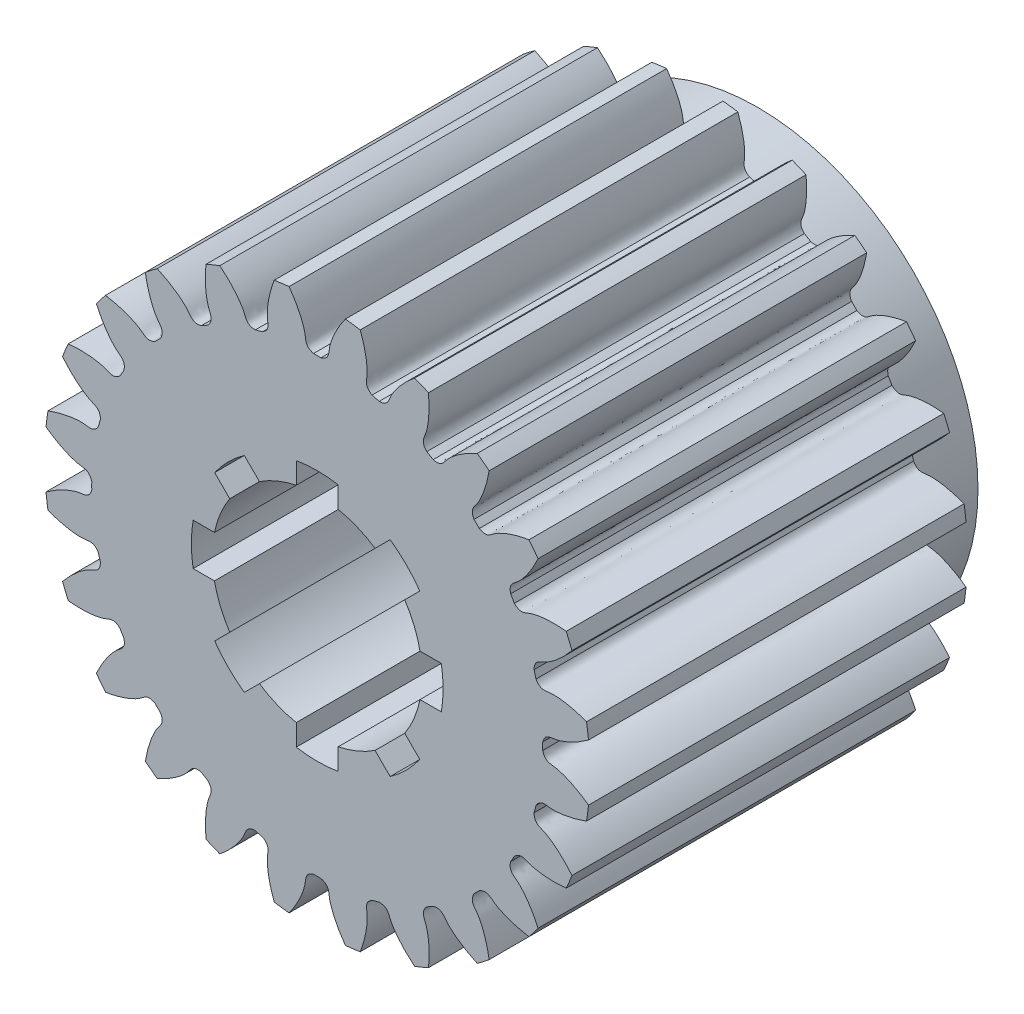
from build123d import *

# Parameters (mm, degrees)
SKETCH_1_R               = 13
EXTRUDE_1_DEPTH          = 18
CUT_EXTRUDE_1_DEPTH      = 26.729360661
PATTERN_CIRCULAR_1_COUNT = 24
SKETCH_4_R               = 10.5
EXTRUDE_2_DEPTH          = 3
CUT_EXTRUDE_3_DEPTH      = 28.845957889
CUT_EXTRUDE_3_DEPTH_BACK = 28.845957889


with BuildPart() as part:
    # 草图1 → 凸台-拉伸1 (new body)
    with BuildSketch(Plane.XY):
        Circle(SKETCH_1_R)
    extrude(amount=EXTRUDE_1_DEPTH)

    # 草图2 → 切除-拉伸1 (cut, through all)
    with BuildSketch(Plane.XY):
        with BuildLine():
            ThreePointArc((0.176831912, 10.748545505), (0, 10.75), (-0.176831912, 10.748545505))
            add(Edge.make_bspline(
                [(-0.176831912, 10.748545505), (-0.567912216, 10.856860072), (-0.539047766, 11.115723597), (-0.586277177, 11.372684453), (-0.593035917, 11.405833043), (-0.601448484, 11.443240145), (-0.611680608, 11.484852715), (-0.623905634, 11.530610673), (-0.638292299, 11.580449371), (-0.655008422, 11.634298869), (-0.674219578, 11.692084221), (-0.696089327, 11.753725457), (-0.720778968, 11.819137654), (-0.748447442, 11.88823099), (-0.779251189, 11.96091081), (-0.813344022, 12.037077686), (-0.850876998, 12.116627487), (-0.891998291, 12.199451452), (-0.93685307, 12.285436259), (-0.985583373, 12.374464108), (-1.038327991, 12.466412797), (-1.095222341, 12.561155811), (-1.156398359, 12.658562402), (-1.221984378, 12.758497683), (-1.292105019, 12.860822717), (-1.366881079, 12.965394618), (-1.446429425, 13.072066641), (-1.530862887, 13.180688288), (-1.620290156, 13.291105411), (-1.714815684, 13.403160315), (-1.814539583, 13.516691871), (-1.919557535, 13.63153562), (-2.029960694, 13.747523897), (-2.145835601, 13.864485934), (-2.267264093, 13.982247989), (-2.394323221, 14.10063346), (-2.527085177, 14.21946301), (-2.665617174, 14.338554691), (-2.860422093, 14.499361556), (-3.011923806, 14.616878318), (-3.11561952, 14.694117929)],
                knots=[0, 0, 0, 0, 0.143961355, 0.149818462, 0.156576662, 0.164235955, 0.172796342, 0.182257821, 0.192620395, 0.203884061, 0.216048821, 0.229114674, 0.24308162, 0.25794966, 0.273718793, 0.290389019, 0.307960339, 0.326432751, 0.345806258, 0.366080857, 0.38725655, 0.409333336, 0.432311215, 0.456190188, 0.480970254, 0.506651413, 0.533233666, 0.560717012, 0.589101451, 0.618386984, 0.64857361, 0.679661329, 0.711650141, 0.744540047, 0.778331046, 0.813023138, 0.848616324, 0.885110603, 0.922505975, 1, 1, 1, 1], degree=3))
            ThreePointArc((-3.11561952, 14.694117929), (0, 15.020791814), (3.11561952, 14.694117929))
            add(Edge.make_bspline(
                [(0.176831912, 10.748545505), (0.567912216, 10.856860072), (0.539047766, 11.115723597), (0.586277177, 11.372684453), (0.593035917, 11.405833043), (0.601448484, 11.443240145), (0.611680608, 11.484852715), (0.623905634, 11.530610673), (0.638292299, 11.580449371), (0.655008422, 11.634298869), (0.674219578, 11.692084221), (0.696089327, 11.753725457), (0.720778968, 11.819137654), (0.748447442, 11.88823099), (0.779251189, 11.96091081), (0.813344022, 12.037077686), (0.850876998, 12.116627487), (0.891998291, 12.199451452), (0.93685307, 12.285436259), (0.985583373, 12.374464108), (1.038327991, 12.466412797), (1.095222341, 12.561155811), (1.156398359, 12.658562402), (1.221984378, 12.758497683), (1.292105019, 12.860822717), (1.366881079, 12.965394618), (1.446429425, 13.072066641), (1.530862887, 13.180688288), (1.620290156, 13.291105411), (1.714815684, 13.403160315), (1.814539583, 13.516691871), (1.919557535, 13.63153562), (2.029960694, 13.747523897), (2.145835601, 13.864485934), (2.267264093, 13.982247989), (2.394323221, 14.10063346), (2.527085177, 14.21946301), (2.665617174, 14.338554691), (2.860422093, 14.499361556), (3.011923806, 14.616878318), (3.11561952, 14.694117929)],
                knots=[0, 0, 0, 0, 0.143961355, 0.149818462, 0.156576662, 0.164235955, 0.172796342, 0.182257821, 0.192620395, 0.203884061, 0.216048821, 0.229114674, 0.24308162, 0.25794966, 0.273718793, 0.290389019, 0.307960339, 0.326432751, 0.345806258, 0.366080857, 0.38725655, 0.409333336, 0.432311215, 0.456190188, 0.480970254, 0.506651413, 0.533233666, 0.560717012, 0.589101451, 0.618386984, 0.64857361, 0.679661329, 0.711650141, 0.744540047, 0.778331046, 0.813023138, 0.848616324, 0.885110603, 0.922505975, 1, 1, 1, 1], degree=3))
        make_face()
    cut_extrude_1 = extrude(amount=CUT_EXTRUDE_1_DEPTH, mode=Mode.SUBTRACT)

    # 阵列(圆周)1: 切除-拉伸1 ×24 about axis
    pattern_circular_1_axis = Axis((0, 0, 18), (0, 0, -1))
    for i in range(1, PATTERN_CIRCULAR_1_COUNT):
        add(cut_extrude_1.rotate(pattern_circular_1_axis, i * 360 / PATTERN_CIRCULAR_1_COUNT), mode=Mode.SUBTRACT)

    # 草图4 → 凸台-拉伸2 (add)
    with BuildSketch(Plane(origin=(0, 0, 0), x_dir=(-1, 0, 0), z_dir=(0, 0, -1))):
        Circle(SKETCH_4_R)
    extrude(amount=EXTRUDE_2_DEPTH)

    # 草图5 → 切除-拉伸3 (cut, two sides: drawn at the far end of the back side and taken through both)
    with BuildSketch(Plane(origin=(0, 0, -3), x_dir=(-1, 0, 0), z_dir=(0, 0, -1)).offset(-CUT_EXTRUDE_3_DEPTH_BACK)):
        with BuildLine():
            ThreePointArc((1, 5.916079783), (0, 6), (-1, 5.916079783))
            Line((-1, 5.916079783), (-1, 4.898979486))
            ThreePointArc((-1, 4.898979486), (-1.913417162, 4.619397663), (-2.756994834, 4.171208396))
            Line((-2.756994834, 4.171208396), (-3.476193351, 4.890406914))
            ThreePointArc((-3.476193351, 4.890406914), (-4.242640687, 4.242640687), (-4.890406914, 3.476193351))
            Line((-4.890406914, 3.476193351), (-4.171208396, 2.756994834))
            ThreePointArc((-4.171208396, 2.756994834), (-4.619397663, 1.913417162), (-4.898979486, 1))
            Line((-4.898979486, 1), (-5.916079783, 1))
            ThreePointArc((-5.916079783, 1), (-6, 0), (-5.916079783, -1))
            Line((-5.916079783, -1), (-4.898979486, -1))
            ThreePointArc((-4.898979486, -1), (-4.619397663, -1.913417162), (-4.171208396, -2.756994834))
            Line((-4.171208396, -2.756994834), (-4.890406914, -3.476193351))
            ThreePointArc((-4.890406914, -3.476193351), (-4.242640687, -4.242640687), (-3.476193351, -4.890406914))
            Line((-3.476193351, -4.890406914), (-2.756994834, -4.171208396))
            ThreePointArc((-2.756994834, -4.171208396), (-1.913417162, -4.619397663), (-1, -4.898979486))
            Line((-1, -4.898979486), (-1, -5.916079783))
            ThreePointArc((-1, -5.916079783), (0, -6), (1, -5.916079783))
            Line((1, -5.916079783), (1, -4.898979486))
            ThreePointArc((1, -4.898979486), (1.913417162, -4.619397663), (2.756994834, -4.171208396))
            Line((2.756994834, -4.171208396), (3.476193351, -4.890406914))
            ThreePointArc((3.476193351, -4.890406914), (4.242640687, -4.242640687), (4.890406914, -3.476193351))
            Line((4.890406914, -3.476193351), (4.171208396, -2.756994834))
            ThreePointArc((4.171208396, -2.756994834), (4.619397663, -1.913417162), (4.898979486, -1))
            Line((4.898979486, -1), (5.916079783, -1))
            ThreePointArc((5.916079783, -1), (6, 0), (5.916079783, 1))
            Line((5.916079783, 1), (4.898979486, 1))
            ThreePointArc((4.898979486, 1), (4.619397663, 1.913417162), (4.171208396, 2.756994834))
            Line((4.171208396, 2.756994834), (4.890406914, 3.476193351))
            ThreePointArc((4.890406914, 3.476193351), (4.242640687, 4.242640687), (3.476193351, 4.890406914))
            Line((3.476193351, 4.890406914), (2.756994834, 4.171208396))
            ThreePointArc((2.756994834, 4.171208396), (1.913417162, 4.619397663), (1, 4.898979486))
            Line((1, 4.898979486), (1, 5.916079783))
        make_face()
    extrude(amount=CUT_EXTRUDE_3_DEPTH + CUT_EXTRUDE_3_DEPTH_BACK, mode=Mode.SUBTRACT)


solid = part.part
